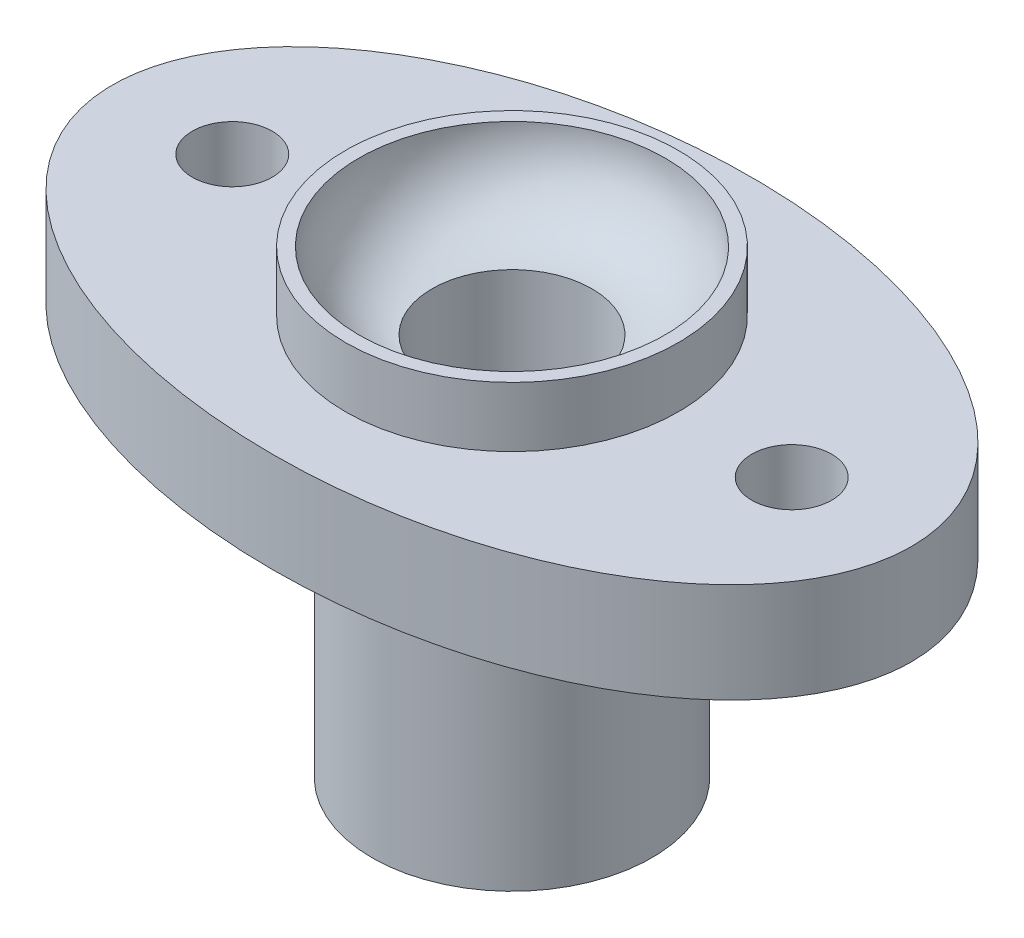
from build123d import *

# Parameters (mm, degrees)
SKETCH1_R           = 21
SKETCH1_R_2         = 12
BOSS_EXTRUDE1_DEPTH = 45
SKETCH4_RX          = 60
SKETCH4_RY          = 36
SKETCH4_R           = 6
SKETCH4_R_2         = 12
BOSS_EXTRUDE2_DEPTH = 15
SKETCH5_R           = 25
BOSS_EXTRUDE3_DEPTH = 9


with BuildPart() as part:
    # Sketch1 → Boss-Extrude1 (new body)
    with BuildSketch(Plane(origin=(0, 0, 0), x_dir=(1, 0, 0), z_dir=(0, 1, 0))):
        with Locations(Location((0, 0, 0), (0, 0, 90))):
            Circle(SKETCH1_R)
        with Locations(Location((0, 0, 0), (0, 0, 90))):
            Circle(SKETCH1_R_2, mode=Mode.SUBTRACT)
    extrude(amount=BOSS_EXTRUDE1_DEPTH)

    # Sketch4 → Boss-Extrude2 (add)
    with BuildSketch(Plane(origin=(0, 45, 0), x_dir=(1, 0, 0), z_dir=(0, 1, 0))):
        with Locations((0, 0)):
            Ellipse(SKETCH4_RX, SKETCH4_RY)
        with Locations(Location((-42, 0, 0), (0, 0, 270))):
            Circle(SKETCH4_R, mode=Mode.SUBTRACT)
        with Locations(Location((42, 0, 0), (0, 0, 90))):
            Circle(SKETCH4_R, mode=Mode.SUBTRACT)
        with Locations(Location((0, 0, 0), (0, 0, 90))):
            Circle(SKETCH4_R_2, mode=Mode.SUBTRACT)
    extrude(amount=BOSS_EXTRUDE2_DEPTH)

    # Sketch5 → Boss-Extrude3 (add)
    with BuildSketch(Plane(origin=(0, 60, 0), x_dir=(1, 0, 0), z_dir=(0, 1, 0))):
        with Locations(Location((0, 0, 0), (0, 0, 270))):
            Circle(SKETCH5_R)
    extrude(amount=BOSS_EXTRUDE3_DEPTH)

    # Sketch6 → Cut-Revolve1 (revolve, cut)
    with BuildSketch(Plane.XY, mode=Mode.PRIVATE) as cut_revolve1_sk:
        with BuildLine():
            Line((-11.5, 57.5), (0, 57.5))
            Line((0, 57.5), (0, 80.5))
            Line((0, 80.5), (-11.5, 80.5))
            ThreePointArc((-11.5, 80.5), (-23, 69), (-11.5, 57.5))
        make_face()
    revolve(cut_revolve1_sk.sketch.rotate(Axis((0, 0, 0), (0, 1, 0)), 270), axis=Axis((0, 0, 0), (0, 1, 0)), mode=Mode.SUBTRACT)

    # Sketch7 → Cut-Revolve2 (revolve, cut)
    with BuildSketch(Plane.XY, mode=Mode.PRIVATE) as cut_revolve2_sk:
        Polygon((0, 0), (-21, 0), (0, 5.626933041), align=None)
    revolve(cut_revolve2_sk.sketch.rotate(Axis((0, 0, 0), (0, 1, 0)), 270), axis=Axis((0, 0, 0), (0, 1, 0)), mode=Mode.SUBTRACT)


solid = part.part
